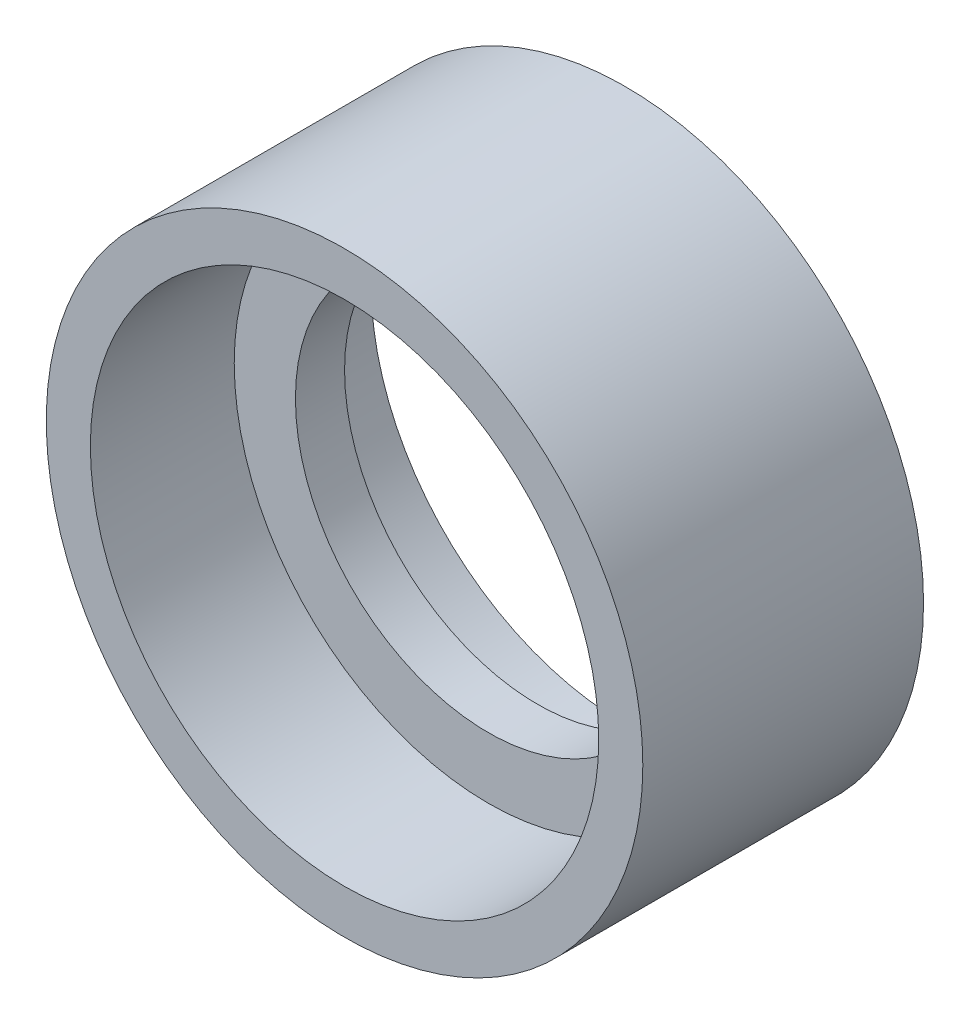
from build123d import *

# Parameters (mm, degrees)
SKETCH1_R           = 13.49375
BOSS_EXTRUDE1_DEPTH = 12.7
SKETCH3_R           = 11.5
CUT_EXTRUDE2_DEPTH  = 23.922752412
SKETCH4_R           = 11.5
BOSS_EXTRUDE2_DEPTH = 2.2225
SKETCH5_R           = 8.73125
CUT_EXTRUDE3_DEPTH  = 21.162499961


with BuildPart() as part:
    # Sketch1 → Boss-Extrude1 (new body)
    with BuildSketch(Plane.XY):
        Circle(SKETCH1_R)
    extrude(amount=BOSS_EXTRUDE1_DEPTH)

    # Sketch3 → Cut-Extrude2 (cut, through all)
    with BuildSketch(Plane(origin=(0, 0, 0), x_dir=(-1, 0, 0), z_dir=(0, 0, -1))):
        Circle(SKETCH3_R)
    extrude(amount=-CUT_EXTRUDE2_DEPTH, mode=Mode.SUBTRACT)

    # Sketch4 → Boss-Extrude2 (add)
    with BuildSketch(Plane(origin=(0, 0, 3.96875), x_dir=(-1, 0, 0), z_dir=(0, 0, -1))):
        Circle(SKETCH4_R)
    extrude(amount=-BOSS_EXTRUDE2_DEPTH)

    # Sketch5 → Cut-Extrude3 (cut, through all)
    with BuildSketch(Plane.XY.offset(6.19125)):
        Circle(SKETCH5_R)
    extrude(amount=-CUT_EXTRUDE3_DEPTH, mode=Mode.SUBTRACT)


solid = part.part
